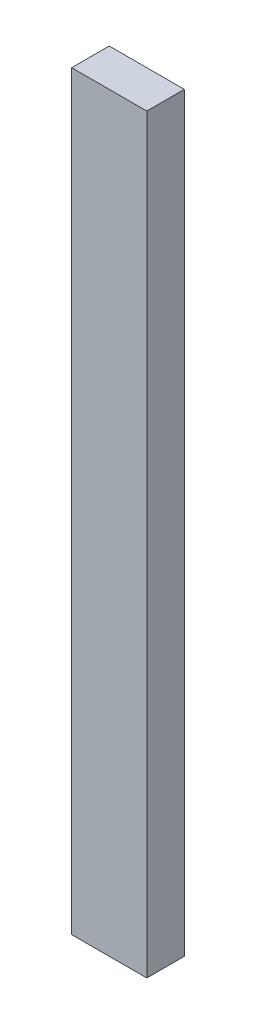
from build123d import *

# Parameters (mm, degrees)
SKETCH_1_W      = 40
SKETCH_1_H      = 20
EXTRUDE_1_DEPTH = 400


with BuildPart() as part:
    # Эскиз1 → Бобышка-Вытянуть1 (new body)
    with BuildSketch(Plane(origin=(0, 0, 0), x_dir=(1, 0, 0), z_dir=(0, 1, 0))):
        with Locations((20, 10)):
            Rectangle(SKETCH_1_W, SKETCH_1_H)
    extrude(amount=EXTRUDE_1_DEPTH)


solid = part.part
